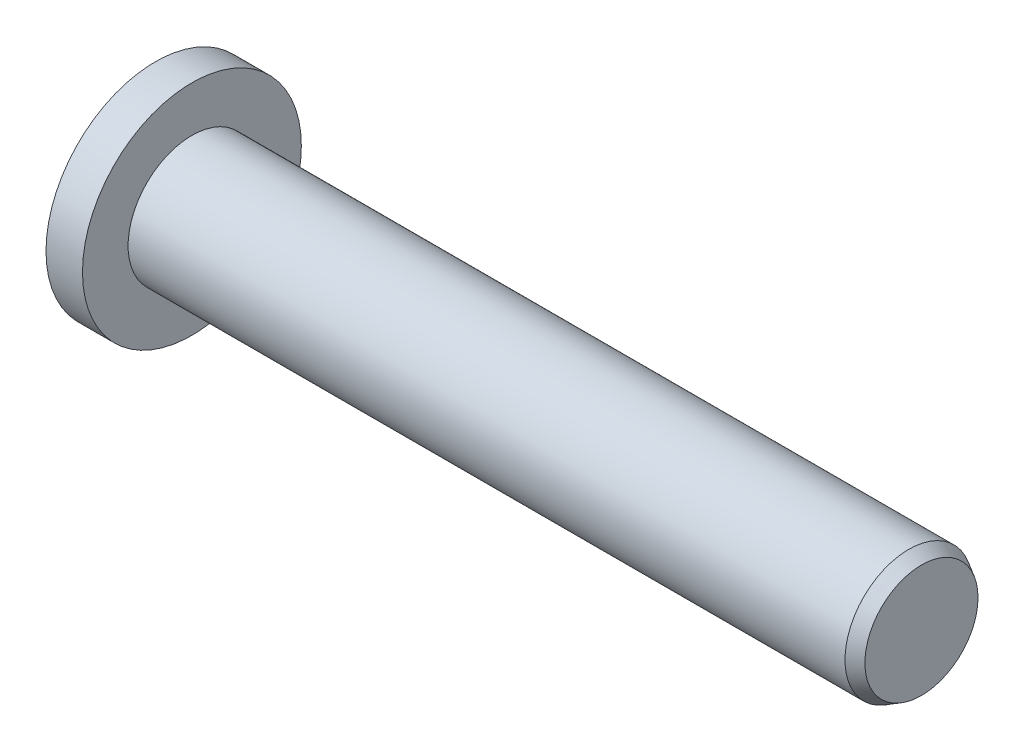
from build123d import *


with BuildPart() as part:
    # Эскиз1 → Повернуть1 (revolve)
    with BuildSketch(Plane.XY, mode=Mode.PRIVATE) as revolve_1_sk:
        Polygon((0, 0), (0, 3), (1, 3), (1, 1.75), (20.653589838, 1.75), (21, 1.55), (21, 0), align=None)
    revolve(revolve_1_sk.sketch.rotate(Axis((0, 0, 0), (-1, 0, 0)), 90), axis=Axis((0, 0, 0), (-1, 0, 0)))


solid = part.part
